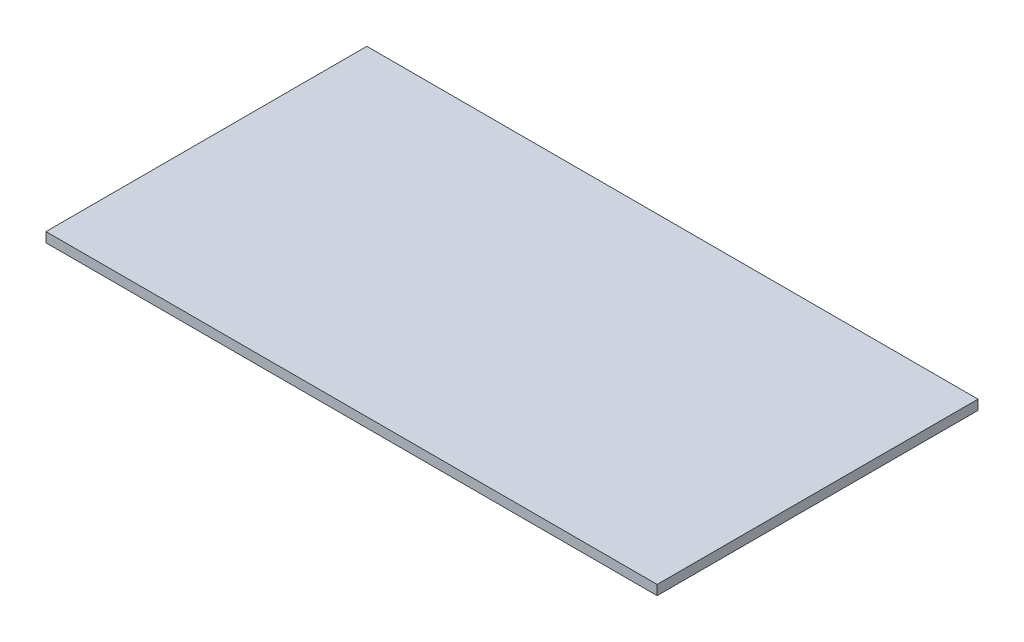
from build123d import *

# Parameters (mm, degrees)
SKETCH1_W           = 101.6
SKETCH1_H           = 53.34
BOSS_EXTRUDE1_DEPTH = 1.6256


with BuildPart() as part:
    # Sketch1 → Boss-Extrude1 (new body)
    with BuildSketch(Plane(origin=(0, 0, 0), x_dir=(1, 0, 0), z_dir=(0, 1, 0))):
        with Locations((50.8, 26.67)):
            Rectangle(SKETCH1_W, SKETCH1_H)
    extrude(amount=BOSS_EXTRUDE1_DEPTH)


solid = part.part
